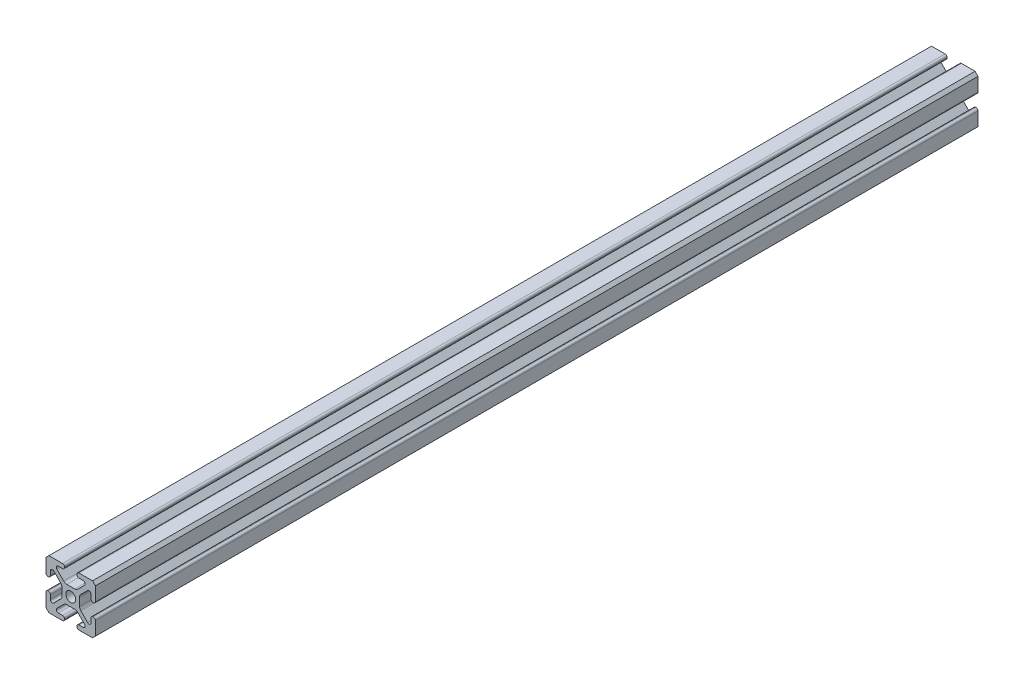
from build123d import *

# Parameters (mm, degrees)
BOSS_EXTRUDE1_DEPTH = 453.48


with BuildPart() as part:
    # Sketch1 → Boss-Extrude1 (new body)
    with BuildSketch(Plane.XY):
        with BuildLine():
            Line((-11.199951579, -12.7), (-4.222256762, -12.7))
            ThreePointArc((-4.222256762, -12.7), (-3.503836272, -12.40242049), (-3.206256762, -11.684))
            Line((-3.206256762, -11.684), (-3.206256762, -11.440665395))
            ThreePointArc((-3.206256762, -11.440665395), (-3.503836272, -10.722244905), (-4.222256762, -10.424665395))
            Line((-4.222256762, -10.424665395), (-6.40926672, -10.424665395))
            ThreePointArc((-6.40926672, -10.424665395), (-7.347928334, -9.797471742), (-7.127687178, -8.690244874))
            Line((-7.127687178, -8.690244874), (-3.593166694, -5.155724698))
            ThreePointArc((-3.593166694, -5.155724698), (-2.876257435, -4.67670128), (-2.030605322, -4.508490626))
            Line((-2.030605322, -4.508490626), (2.030598864, -4.508490626))
            ThreePointArc((2.030598864, -4.508490626), (2.876251031, -4.676701303), (3.593160319, -5.155724782))
            Line((3.593160319, -5.155724782), (7.127680379, -8.690244912))
            ThreePointArc((7.127680379, -8.690244912), (7.347921489, -9.019859032), (7.425259882, -9.408665395))
            ThreePointArc((7.425259882, -9.408665395), (7.127680372, -10.127085884), (6.409259882, -10.424665395))
            Line((6.409259882, -10.424665395), (4.22225065, -10.424665395))
            ThreePointArc((4.22225065, -10.424665395), (3.50383016, -10.722244905), (3.20625065, -11.440665395))
            Line((3.20625065, -11.440665395), (3.20625065, -11.684))
            ThreePointArc((3.20625065, -11.684), (3.50383016, -12.40242049), (4.22225065, -12.7))
            Line((4.22225065, -12.7), (11.199952422, -12.7))
            Line((11.199952422, -12.7), (12.7, -11.199951732))
            Line((12.7, -11.199951732), (12.7, -4.222256762))
            ThreePointArc((12.7, -4.222256762), (12.40242049, -3.503836272), (11.684, -3.206256762))
            Line((11.684, -3.206256762), (11.440665395, -3.206256762))
            ThreePointArc((11.440665395, -3.206256762), (10.722244905, -3.503836272), (10.424665395, -4.222256762))
            Line((10.424665395, -4.222256762), (10.424665395, -6.40926672))
            ThreePointArc((10.424665395, -6.40926672), (9.797471742, -7.347928334), (8.690244874, -7.127687178))
            Line((8.690244874, -7.127687178), (5.155724698, -3.593166694))
            ThreePointArc((5.155724698, -3.593166694), (4.67670128, -2.876257435), (4.508490626, -2.030605322))
            Line((4.508490626, -2.030605322), (4.508490626, 2.030598864))
            ThreePointArc((4.508490626, 2.030598864), (4.676701303, 2.876251031), (5.155724782, 3.593160319))
            Line((5.155724782, 3.593160319), (8.690244912, 7.127680379))
            ThreePointArc((8.690244912, 7.127680379), (9.019859032, 7.347921489), (9.408665395, 7.425259882))
            ThreePointArc((9.408665395, 7.425259882), (10.127085884, 7.127680372), (10.424665395, 6.409259882))
            Line((10.424665395, 6.409259882), (10.424665395, 4.22225065))
            ThreePointArc((10.424665395, 4.22225065), (10.722244905, 3.50383016), (11.440665395, 3.20625065))
            Line((11.440665395, 3.20625065), (11.684, 3.20625065))
            ThreePointArc((11.684, 3.20625065), (12.40242049, 3.50383016), (12.7, 4.22225065))
            Line((12.7, 4.22225065), (12.7, 11.199954756))
            Line((12.7, 11.199954756), (11.199954423, 12.7))
            Line((11.199954423, 12.7), (4.222256762, 12.7))
            ThreePointArc((4.222256762, 12.7), (3.503836272, 12.40242049), (3.206256762, 11.684))
            Line((3.206256762, 11.684), (3.206256762, 11.440665395))
            ThreePointArc((3.206256762, 11.440665395), (3.503836272, 10.722244905), (4.222256762, 10.424665395))
            Line((4.222256762, 10.424665395), (6.40926672, 10.424665395))
            ThreePointArc((6.40926672, 10.424665395), (7.347928334, 9.797471742), (7.127687178, 8.690244874))
            Line((7.127687178, 8.690244874), (3.593166694, 5.155724698))
            ThreePointArc((3.593166694, 5.155724698), (2.876257435, 4.67670128), (2.030605322, 4.508490626))
            Line((2.030605322, 4.508490626), (-2.030598864, 4.508490626))
            ThreePointArc((-2.030598864, 4.508490626), (-2.876251031, 4.676701303), (-3.593160319, 5.155724782))
            Line((-3.593160319, 5.155724782), (-7.127680379, 8.690244912))
            ThreePointArc((-7.127680379, 8.690244912), (-7.347921489, 9.019859032), (-7.425259882, 9.408665395))
            ThreePointArc((-7.425259882, 9.408665395), (-7.127680372, 10.127085884), (-6.409259882, 10.424665395))
            Line((-6.409259882, 10.424665395), (-4.22225065, 10.424665395))
            ThreePointArc((-4.22225065, 10.424665395), (-3.50383016, 10.722244905), (-3.20625065, 11.440665395))
            Line((-3.20625065, 11.440665395), (-3.20625065, 11.684))
            ThreePointArc((-3.20625065, 11.684), (-3.50383016, 12.40242049), (-4.22225065, 12.7))
            Line((-4.22225065, 12.7), (-11.199951733, 12.7))
            Line((-11.199951733, 12.7), (-12.7, 11.1999514))
            Line((-12.7, 11.1999514), (-12.7, 4.222256762))
            ThreePointArc((-12.7, 4.222256762), (-12.40242049, 3.503836272), (-11.684, 3.206256762))
            Line((-11.684, 3.206256762), (-11.440665395, 3.206256762))
            ThreePointArc((-11.440665395, 3.206256762), (-10.722244905, 3.503836272), (-10.424665395, 4.222256762))
            Line((-10.424665395, 4.222256762), (-10.424665395, 6.40926672))
            ThreePointArc((-10.424665395, 6.40926672), (-9.797471742, 7.347928334), (-8.690244874, 7.127687178))
            Line((-8.690244874, 7.127687178), (-5.155724698, 3.593166694))
            ThreePointArc((-5.155724698, 3.593166694), (-4.67670128, 2.876257435), (-4.508490626, 2.030605322))
            Line((-4.508490626, 2.030605322), (-4.508490626, -2.030598864))
            ThreePointArc((-4.508490626, -2.030598864), (-4.676701303, -2.876251031), (-5.155724782, -3.593160319))
            Line((-5.155724782, -3.593160319), (-8.690244912, -7.127680379))
            ThreePointArc((-8.690244912, -7.127680379), (-9.019859032, -7.347921489), (-9.408665395, -7.425259882))
            ThreePointArc((-9.408665395, -7.425259882), (-10.127085884, -7.127680372), (-10.424665395, -6.409259882))
            Line((-10.424665395, -6.409259882), (-10.424665395, -4.22225065))
            ThreePointArc((-10.424665395, -4.22225065), (-10.722244905, -3.50383016), (-11.440665395, -3.20625065))
            Line((-11.440665395, -3.20625065), (-11.684, -3.20625065))
            ThreePointArc((-11.684, -3.20625065), (-12.40242049, -3.50383016), (-12.7, -4.22225065))
            Line((-12.7, -4.22225065), (-12.7, -11.199952268))
            Line((-12.7, -11.199952268), (-11.199951579, -12.7))
        make_face()
        with BuildLine():
            ThreePointArc((-2.55499489, 0), (0, -2.55499489), (2.55499489, 0))
            ThreePointArc((2.55499489, 0), (0, 2.55499489), (-2.55499489, 0))
        make_face(mode=Mode.SUBTRACT)
    extrude(amount=BOSS_EXTRUDE1_DEPTH)


solid = part.part
